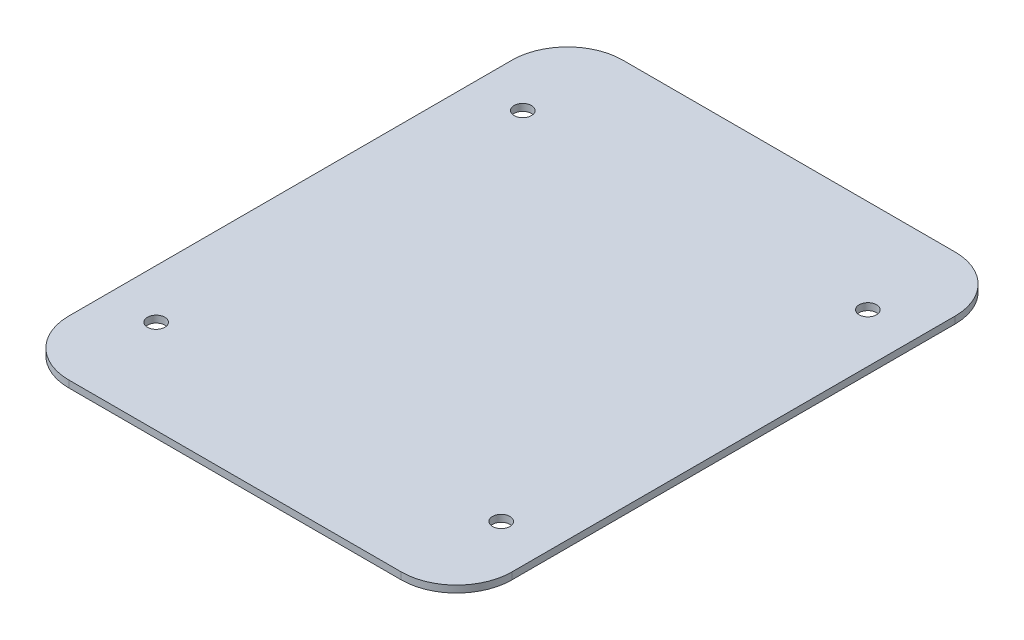
from build123d import *

# Parameters (mm, degrees)
SKETCH1_W           = 203.2
SKETCH1_H           = 254
BOSS_EXTRUDE1_DEPTH = 3.175
FILLET1_R           = 25.4
SKETCH2_R           = 4
CUT_EXTRUDE1_DEPTH  = 25.4


with BuildPart() as part:
    # Sketch1 → Boss-Extrude1 (new body)
    with BuildSketch(Plane(origin=(0, 0, 0), x_dir=(1, 0, 0), z_dir=(0, 1, 0))):
        Rectangle(SKETCH1_W, SKETCH1_H)
    extrude(amount=BOSS_EXTRUDE1_DEPTH)

    # Fillet1
    fillet1_edges = [part.edges().sort_by_distance(p)[0] for p in [
        (101.6, 1.5875, 127),
        (-101.6, 1.5875, 127),
        (-101.6, 1.5875, -127),
        (101.6, 1.5875, -127),
    ]]
    fillet(fillet1_edges, radius=FILLET1_R)

    # Sketch2 → Cut-Extrude1 (cut)
    with BuildSketch(Plane.XZ):
        with Locations(Location((-79.1, 84.050000013, 0), (0, 0, 270))):
            Circle(SKETCH2_R)
        with Locations(Location((79.1, 84.050000013, 0), (0, 0, 270))):
            Circle(SKETCH2_R)
        with Locations(Location((79.1, -84.050000013, 0), (0, 0, 270))):
            Circle(SKETCH2_R)
        with Locations(Location((-79.1, -84.050000013, 0), (0, 0, 270))):
            Circle(SKETCH2_R)
    extrude(amount=-CUT_EXTRUDE1_DEPTH, mode=Mode.SUBTRACT)


solid = part.part
